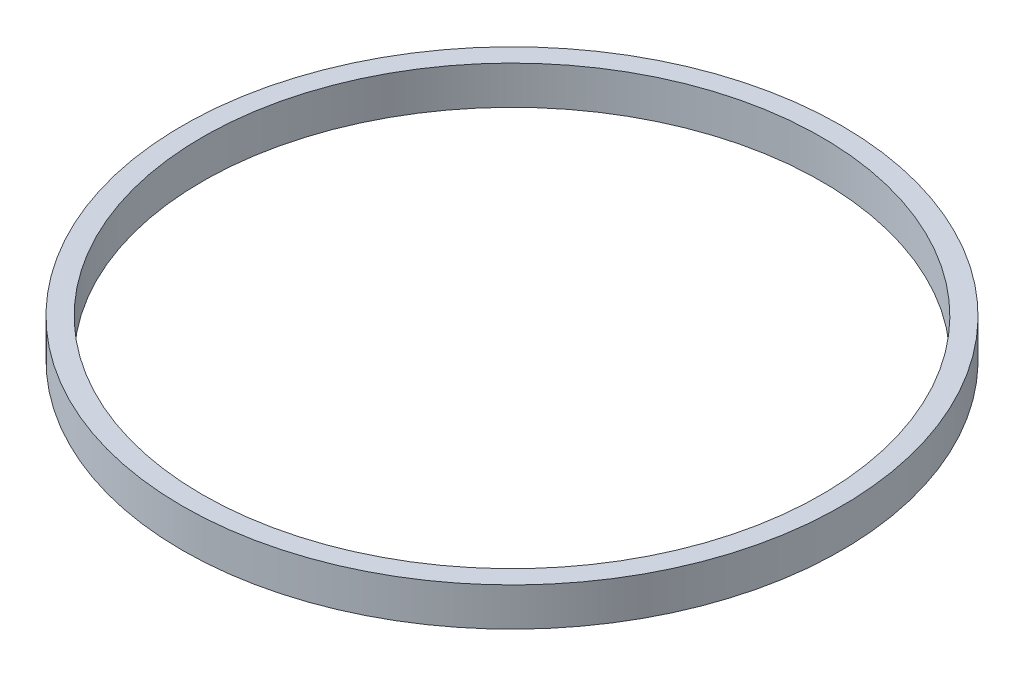
from build123d import *

# Parameters (mm, degrees)
SKETCH1_R           = 21.5
SKETCH1_R_2         = 20.2
BOSS_EXTRUDE1_DEPTH = 2.5


with BuildPart() as part:
    # Sketch1 → Boss-Extrude1 (new body)
    with BuildSketch(Plane(origin=(0, 0, 0), x_dir=(1, 0, 0), z_dir=(0, 1, 0))):
        with Locations(Location((0, 0, 0), (0, 0, 270))):
            Circle(SKETCH1_R)
        with Locations(Location((0, 0, 0), (0, 0, 270))):
            Circle(SKETCH1_R_2, mode=Mode.SUBTRACT)
    extrude(amount=BOSS_EXTRUDE1_DEPTH)


solid = part.part
